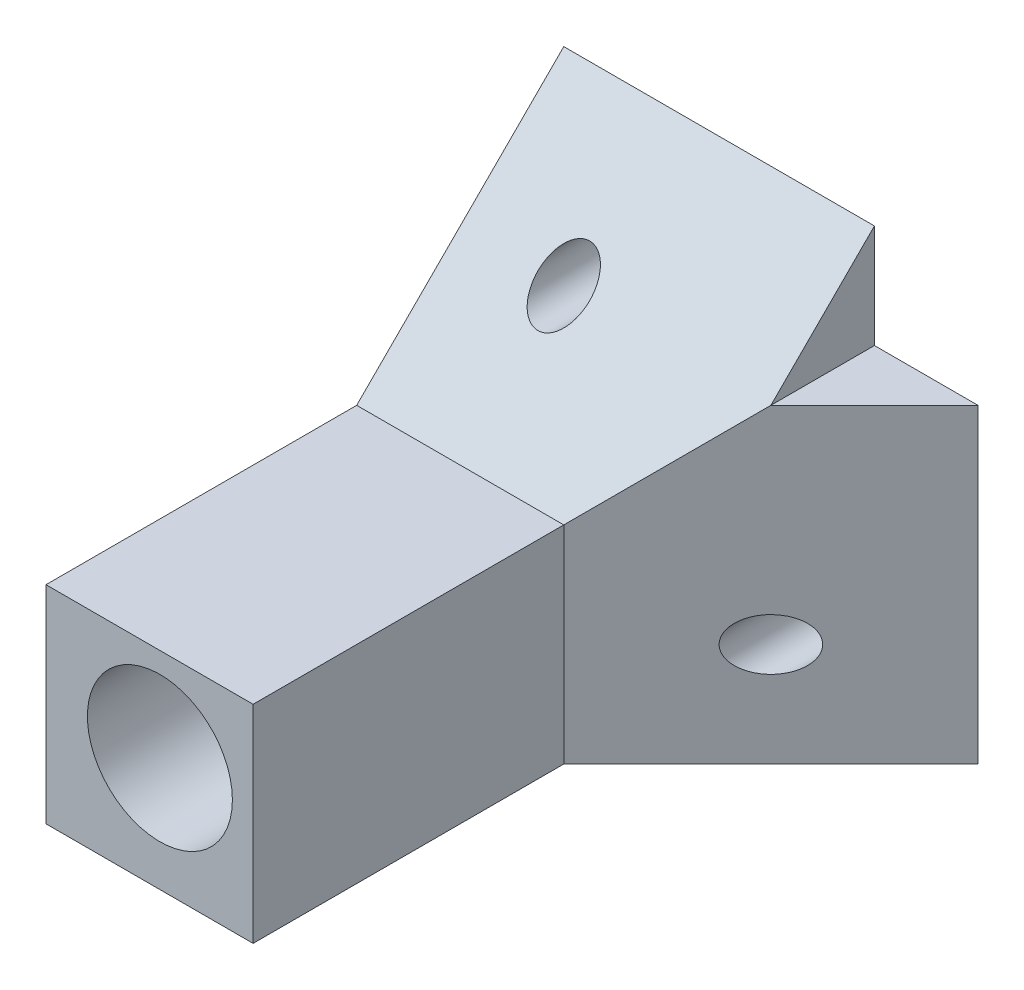
from build123d import *

# Parameters (mm, degrees)
SKETCH_1_W                = 20
SKETCH_1_H                = 20
EXTRUDE_1_DEPTH           = 40
SKETCH_2_W                = 10
SKETCH_2_H                = 15
CUT_EXTRUDE_1_DEPTH       = 7.071067812
PATTERN_CIRCULAR_1_COUNT  = 4
SKETCH_5_R                = 3.5
CUT_EXTRUDE_2_DEPTH       = 25
CUT_EXTRUDE_3_DEPTH       = 5
SKETCH_9_W                = 5.878932188
SKETCH_9_H                = 5.878932188
CUT_EXTRUDE_5_DEPTH       = 5
SKETCH_11_W               = 10
SKETCH_11_H               = 30
EXTRUDE_2_DEPTH           = 10
CUT_EXTRUDE_6_DEPTH       = 30
SKETCH_13_R               = 1.25
CUT_EXTRUDE_7_DEPTH       = 10
PATTERN_CIRCULAR_2_COUNT  = 4
SKETCH_16_W               = 20
SKETCH_16_H               = 10
CUT_EXTRUDE_11_DEPTH      = 40
SKETCH_17_W               = 20
SKETCH_17_H               = 20
SKETCH_17_W_2             = 5.857864376
SKETCH_17_H_2             = 5.857864376
CUT_EXTRUDE_12_DEPTH      = 5
CUT_EXTRUDE_13_DEPTH      = 54.851648071
CUT_EXTRUDE_13_DEPTH_BACK = 10
SKETCH_19_W               = 81.536041923
SKETCH_19_H               = 68.786769913
CUT_EXTRUDE_16_DEPTH      = 400
SKETCH_20_W               = 73.081310303
SKETCH_20_H               = 44.358386444
CUT_EXTRUDE_18_DEPTH      = 400


with BuildPart() as part:
    # 스케치1 → 보스-돌출1 (new body)
    with BuildSketch(Plane.XY):
        Rectangle(SKETCH_1_W, SKETCH_1_H)
    extrude(amount=EXTRUDE_1_DEPTH)

    # 스케치2 → 컷-돌출1 (cut)
    with BuildSketch(Plane(origin=(10, 0, 0), x_dir=(0, 0, -1), z_dir=(1, 0, 0))):
        with Locations((-10, 0)):
            Rectangle(SKETCH_2_W, SKETCH_2_H)
    cut_extrude_1 = extrude(amount=-CUT_EXTRUDE_1_DEPTH, mode=Mode.SUBTRACT)

    # 원형 패턴1: 컷-돌출1 ×4 about axis
    pattern_circular_1_axis = Axis((0, 0, 0), (0, 0, 1))
    for i in range(1, PATTERN_CIRCULAR_1_COUNT):
        add(cut_extrude_1.rotate(pattern_circular_1_axis, i * 360 / PATTERN_CIRCULAR_1_COUNT), mode=Mode.SUBTRACT)

    # 스케치5 → 컷-돌출2 (cut)
    with BuildSketch(Plane.XY.offset(40)):
        with Locations((-5.5, 5.5)):
            Circle(SKETCH_5_R)
        with Locations((5.5, 5.5)):
            Circle(SKETCH_5_R)
        with Locations(Location((-5.5, -5.5, 0), (0, 0, 235.150095421))):
            Circle(SKETCH_5_R)
        with Locations(Location((5.5, -5.5, 0), (0, 0, 304.849904579))):
            Circle(SKETCH_5_R)
    extrude(amount=-CUT_EXTRUDE_2_DEPTH, mode=Mode.SUBTRACT)

    # 스케치6 → 컷-돌출3 (cut)
    with BuildSketch(Plane(origin=(0, 0, 0), x_dir=(-1, 0, 0), z_dir=(0, 0, -1))):
        Polygon((-14.808802863, -2.95), (-14.808802863, 2.95), (-2.95, 2.95), (-2.95, 12.360254216), (2.95, 12.360254216), (2.95, 2.95), (13.852115441, 2.95), (13.852115441, -2.95), (2.95, -2.95), (2.95, -13.975695818), (-2.95, -13.975695818), (-2.95, -2.95), align=None)
    extrude(amount=-CUT_EXTRUDE_3_DEPTH, mode=Mode.SUBTRACT)

    # 스케치9 → 컷-돌출5 (cut)
    with BuildSketch(Plane(origin=(0, 0, 5), x_dir=(-1, 0, 0), z_dir=(0, 0, -1))):
        with Locations((0.010533906, -0.010533906)):
            Rectangle(SKETCH_9_W, SKETCH_9_H)
    extrude(amount=-CUT_EXTRUDE_5_DEPTH, mode=Mode.SUBTRACT)

    # 스케치11 → 보스-돌출2 (add)
    with BuildSketch(Plane(origin=(10, 0, 0), x_dir=(0, 0, -1), z_dir=(1, 0, 0))):
        with Locations((-20, 0)):
            Rectangle(SKETCH_11_W, SKETCH_11_H)
    extrude_2 = extrude(amount=EXTRUDE_2_DEPTH)

    # 스케치12 → 컷-돌출6 (cut)
    with BuildSketch(Plane(origin=(0, 15, 0), x_dir=(1, 0, 0), z_dir=(0, 1, 0))):
        Polygon((20, -15), (10, -25), (20, -25), align=None)
    cut_extrude_6 = extrude(amount=-CUT_EXTRUDE_6_DEPTH, mode=Mode.SUBTRACT)

    # 스케치13 → 컷-돌출7 (cut)
    with BuildSketch(Plane(origin=(0, 0, 15), x_dir=(-1, 0, 0), z_dir=(0, 0, -1))):
        with Locations(Location((-15, -5, 0), (0, 0, 90))):
            Circle(SKETCH_13_R)
        with Locations(Location((-15, 5, 0), (0, 0, 90))):
            Circle(SKETCH_13_R)
    cut_extrude_7 = extrude(amount=-CUT_EXTRUDE_7_DEPTH, mode=Mode.SUBTRACT)

    # 원형 패턴2: 보스-돌출2, 컷-돌출6, 컷-돌출7 ×4 about axis
    pattern_circular_2_axis = Axis((0, 0, 0), (0, 0, 1))
    add([extrude_2.rotate(pattern_circular_2_axis, i * 360 / PATTERN_CIRCULAR_2_COUNT) for i in range(1, PATTERN_CIRCULAR_2_COUNT)])
    add([cut_extrude_6.rotate(pattern_circular_2_axis, i * 360 / PATTERN_CIRCULAR_2_COUNT) for i in range(1, PATTERN_CIRCULAR_2_COUNT)], mode=Mode.SUBTRACT)
    add([cut_extrude_7.rotate(pattern_circular_2_axis, i * 360 / PATTERN_CIRCULAR_2_COUNT) for i in range(1, PATTERN_CIRCULAR_2_COUNT)], mode=Mode.SUBTRACT)

    # 스케치16 → 컷-돌출11 (cut)
    with BuildSketch(Plane.XZ.offset(10)):
        with Locations((0, 5)):
            Rectangle(SKETCH_16_W, SKETCH_16_H)
    extrude(amount=-CUT_EXTRUDE_11_DEPTH, mode=Mode.SUBTRACT)

    # 스케치17 → 컷-돌출12 (cut)
    with BuildSketch(Plane(origin=(0, 0, 10), x_dir=(-1, 0, 0), z_dir=(0, 0, -1))):
        Rectangle(SKETCH_17_W, SKETCH_17_H)
        Rectangle(SKETCH_17_W_2, SKETCH_17_H_2, mode=Mode.SUBTRACT)
    extrude(amount=-CUT_EXTRUDE_12_DEPTH, mode=Mode.SUBTRACT)

    # 스케치18 → 컷-돌출13 (cut, two sides: drawn at the far end of the back side and taken through both)
    with BuildSketch(Plane.XZ.offset(-10).offset(-CUT_EXTRUDE_13_DEPTH_BACK)):
        Polygon((10, 25), (15, 25), (15, 20), align=None)
    extrude(amount=CUT_EXTRUDE_13_DEPTH + CUT_EXTRUDE_13_DEPTH_BACK, mode=Mode.SUBTRACT)

    # 스케치19 → 컷-돌출16 (cut)
    with BuildSketch(Plane(origin=(0, 0, 0), x_dir=(1, 0, 0), z_dir=(0, 1, 0))):
        with Locations((9.636077682, -26.334226141)):
            Rectangle(SKETCH_19_W, SKETCH_19_H)
    extrude(amount=-CUT_EXTRUDE_16_DEPTH, mode=Mode.SUBTRACT)

    # 스케치20 → 컷-돌출18 (cut)
    with BuildSketch(Plane(origin=(0, 0, 0), x_dir=(0, 0, -1), z_dir=(1, 0, 0))):
        with Locations((-16.834813983, 6.467543638)):
            Rectangle(SKETCH_20_W, SKETCH_20_H)
    extrude(amount=-CUT_EXTRUDE_18_DEPTH, mode=Mode.SUBTRACT)


solid = part.part
